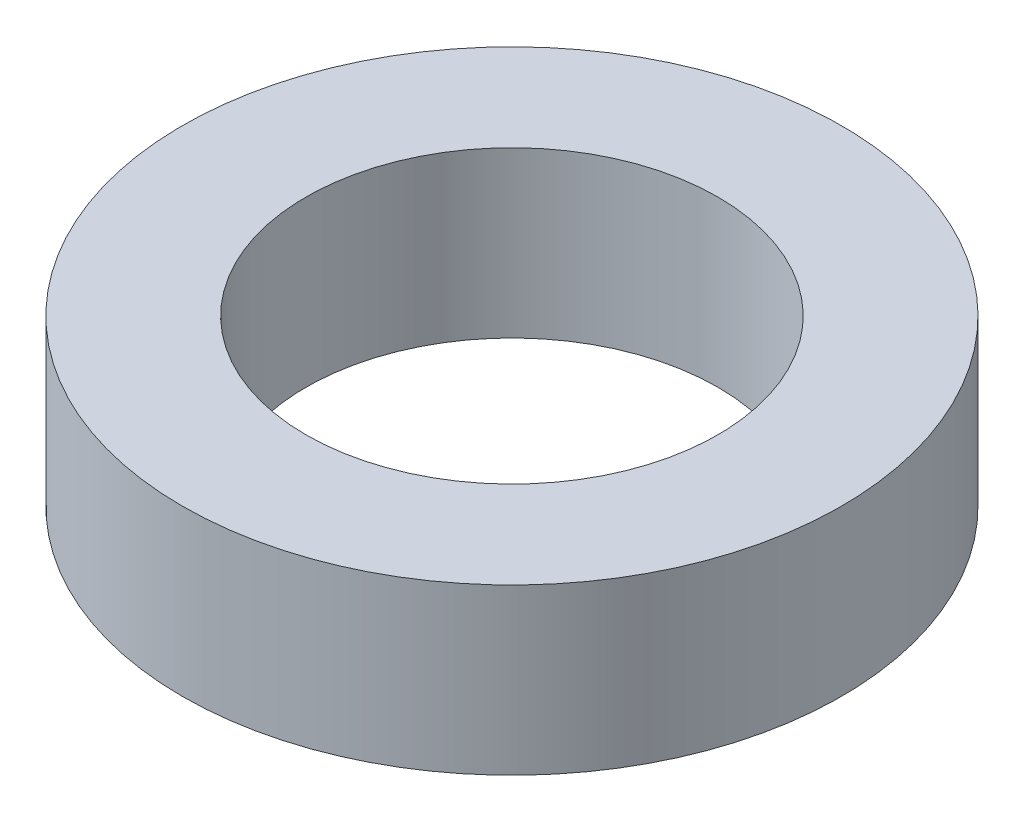
from build123d import *

# Parameters (mm, degrees)
SKETCH1_R           = 6.35
SKETCH1_R_2         = 3.96875
BOSS_EXTRUDE1_DEPTH = 3.175


with BuildPart() as part:
    # Sketch1 → Boss-Extrude1 (new body)
    with BuildSketch(Plane(origin=(0, 0, 0), x_dir=(1, 0, 0), z_dir=(0, 1, 0))):
        with Locations(Location((0, 0, 0), (0, 0, 270))):
            Circle(SKETCH1_R)
        with Locations(Location((0, 0, 0), (0, 0, 270))):
            Circle(SKETCH1_R_2, mode=Mode.SUBTRACT)
    extrude(amount=BOSS_EXTRUDE1_DEPTH)


solid = part.part
